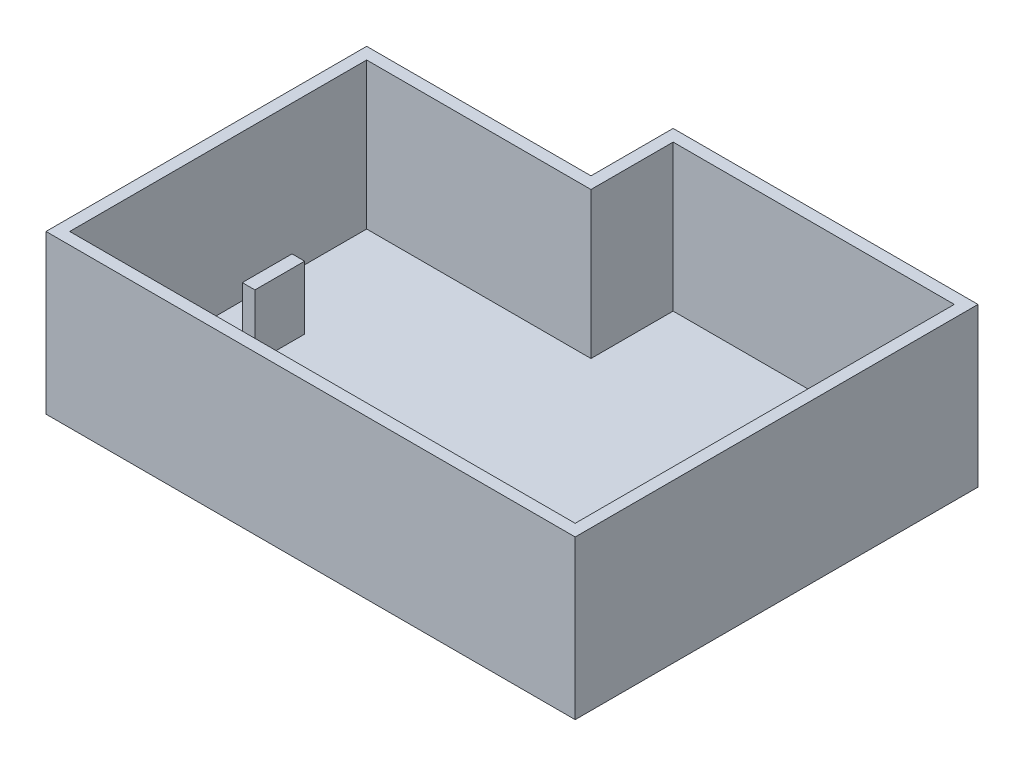
from build123d import *

# Parameters (mm, degrees)
CROQUIS1_W              = 212.725
CROQUIS1_H              = 187.325
CROQUIS1_W_2            = 203.2
CROQUIS1_H_2            = 177.8
SALIENTE_EXTRUIR1_DEPTH = 63.607999784
VACIADO1_T              = -4.7625
CROQUIS2_W              = 20
CROQUIS2_H              = 5.08
CROQUIS2_W_2            = 5.08
CROQUIS2_H_2            = 20
SALIENTE_EXTRUIR3_DEPTH = 25.4
CROQUIS2_5_W            = 5.08
CROQUIS2_5_H            = 20
CROQUIS2_5_W_2          = 20
CROQUIS2_5_H_2          = 5.08
SALIENTE_EXTRUIR4_DEPTH = 6.5
CROQUIS3_W              = 94.9325
CROQUIS3_H              = 63.1825
CORTAR_EXTRUIR1_DEPTH   = 156.343564234
SALIENTE_EXTRUIR5_DEPTH = 63.607999784
CROQUIS5_W              = 122.555
CROQUIS5_H              = 30.1625
CORTAR_EXTRUIR2_DEPTH   = 156.343564234
CROQUIS6_W              = 122.555
CROQUIS6_H              = 4.7625
SALIENTE_EXTRUIR6_DEPTH = 63.607999784
CROQUIS7_W              = 154.94
CROQUIS7_H              = 82.660152575
CORTAR_EXTRUIR3_DEPTH   = 58.845499784
CROQUIS8_W              = 212.725
CROQUIS8_H              = 63.607999784
CORTAR_EXTRUIR4_DEPTH   = 364.431583545


with BuildPart() as part:
    # Croquis1 → Saliente-Extruir1 (new body)
    # profile 1 of 2: a face of its own
    with BuildSketch(Plane(origin=(0, 0, 0), x_dir=(1, 0, 0), z_dir=(0, 1, 0))):
        Rectangle(CROQUIS1_W, CROQUIS1_H)
        Rectangle(CROQUIS1_W_2, CROQUIS1_H_2, mode=Mode.SUBTRACT)
    # profile 2 of 2: a face of its own
    with BuildSketch(Plane(origin=(0, 0, 0), x_dir=(1, 0, 0), z_dir=(0, 1, 0))):
        Rectangle(CROQUIS1_W_2, CROQUIS1_H_2)
    extrude(amount=SALIENTE_EXTRUIR1_DEPTH)

    # Vaciado1
    vaciado1_openings = [part.faces().sort_by_distance(p)[0] for p in [
        (0, 63.607999784, 0),
    ]]
    offset(amount=VACIADO1_T, openings=vaciado1_openings, kind=Kind.INTERSECTION)

    # Croquis2 → Saliente-Extruir3 (add)
    with BuildSketch(Plane(origin=(0, 4.7625, 0), x_dir=(1, 0, 0), z_dir=(0, 1, 0))):
        with Locations((-44.45, 66.04)):
            Rectangle(CROQUIS2_W, CROQUIS2_H)
        with Locations((-80.01, 0)):
            Rectangle(CROQUIS2_W_2, CROQUIS2_H_2)
        with Locations((0, -67.31)):
            Rectangle(CROQUIS2_W, CROQUIS2_H)
        with Locations((80.01, -28.575)):
            Rectangle(CROQUIS2_W_2, CROQUIS2_H_2)
    extrude(amount=SALIENTE_EXTRUIR3_DEPTH)

    # Croquis2<5> → Saliente-Extruir4 (add)
    with BuildSketch(Plane(origin=(0, 4.7625, 0), x_dir=(1, 0, 0), z_dir=(0, 1, 0))):
        with Locations((-74.93, 0)):
            Rectangle(CROQUIS2_5_W, CROQUIS2_5_H)
        with Locations((0, -62.23)):
            Rectangle(CROQUIS2_5_W_2, CROQUIS2_5_H_2)
        with Locations((74.93, -28.575)):
            Rectangle(CROQUIS2_5_W, CROQUIS2_5_H)
    extrude(amount=SALIENTE_EXTRUIR4_DEPTH)

    # Croquis3 → Cortar-Extruir1 (cut, through all)
    with BuildSketch(Plane(origin=(0, 63.607999784, 0), x_dir=(1, 0, 0), z_dir=(0, 1, 0))):
        with Locations((58.89625, 62.07125)):
            Rectangle(CROQUIS3_W, CROQUIS3_H)
    extrude(amount=-CORTAR_EXTRUIR1_DEPTH, mode=Mode.SUBTRACT)

    # Croquis4 → Saliente-Extruir5 (add)
    with BuildSketch(Plane(origin=(0, 0, 0), x_dir=(1, 0, 0), z_dir=(0, 1, 0))):
        Polygon((11.43, 93.6625), (16.1925, 93.6625), (16.1925, 35.2425), (106.3625, 35.2425), (106.3625, 30.48), (11.43, 30.48), align=None)
    extrude(amount=SALIENTE_EXTRUIR5_DEPTH)

    # Croquis5 → Cortar-Extruir2 (cut, through all)
    with BuildSketch(Plane(origin=(0, 0, 0), x_dir=(1, 0, 0), z_dir=(0, 1, 0))):
        with Locations((-45.085, 78.58125)):
            Rectangle(CROQUIS5_W, CROQUIS5_H)
    extrude(amount=CORTAR_EXTRUIR2_DEPTH, mode=Mode.SUBTRACT)

    # Croquis6 → Saliente-Extruir6 (add)
    with BuildSketch(Plane(origin=(0, 0, 0), x_dir=(1, 0, 0), z_dir=(0, 1, 0))):
        with Locations((-45.085, 65.88125)):
            Rectangle(CROQUIS6_W, CROQUIS6_H)
    extrude(amount=SALIENTE_EXTRUIR6_DEPTH)

    # Croquis7 → Cortar-Extruir3 (cut)
    with BuildSketch(Plane(origin=(0, 63.607999784, 0), x_dir=(1, 0, 0), z_dir=(0, 1, 0))):
        with Locations((0, -23.439923713)):
            Rectangle(CROQUIS7_W, CROQUIS7_H)
    extrude(amount=-CORTAR_EXTRUIR3_DEPTH, mode=Mode.SUBTRACT)


with BuildPart() as body_2:
    # Simetría1: mirrored copy
    add(part.part.mirror(Plane(origin=(106.3625, 63.607999784, 0), x_dir=(0, 0, 1), z_dir=(-1, 0, 0))))


with BuildPart() as part_1:
    add(part.part)

    # Croquis8 → Cortar-Extruir4 (cut, through all)
    with BuildSketch(Plane.XY.offset(93.6625)):
        with Locations((0, 31.803999892)):
            Rectangle(CROQUIS8_W, CROQUIS8_H)
    extrude(amount=-CORTAR_EXTRUIR4_DEPTH, mode=Mode.SUBTRACT)


solid = body_2.part
